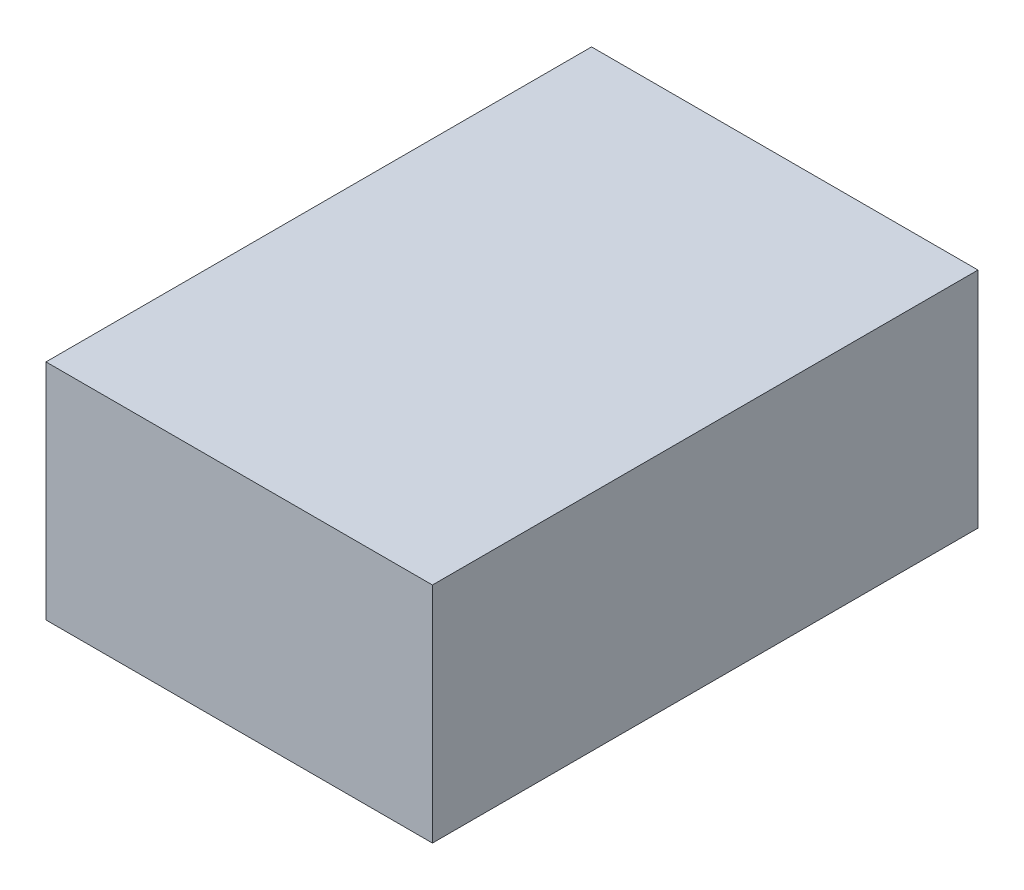
from build123d import *

# Parameters (mm, degrees)
SKETCH1_W           = 10.2
SKETCH1_H           = 14.4
BOSS_EXTRUDE1_DEPTH = 5.9


with BuildPart() as part:
    # Sketch1 → Boss-Extrude1 (new body)
    with BuildSketch(Plane(origin=(0, 0, 0), x_dir=(1, 0, 0), z_dir=(0, 1, 0))):
        Rectangle(SKETCH1_W, SKETCH1_H)
    extrude(amount=BOSS_EXTRUDE1_DEPTH)


solid = part.part
